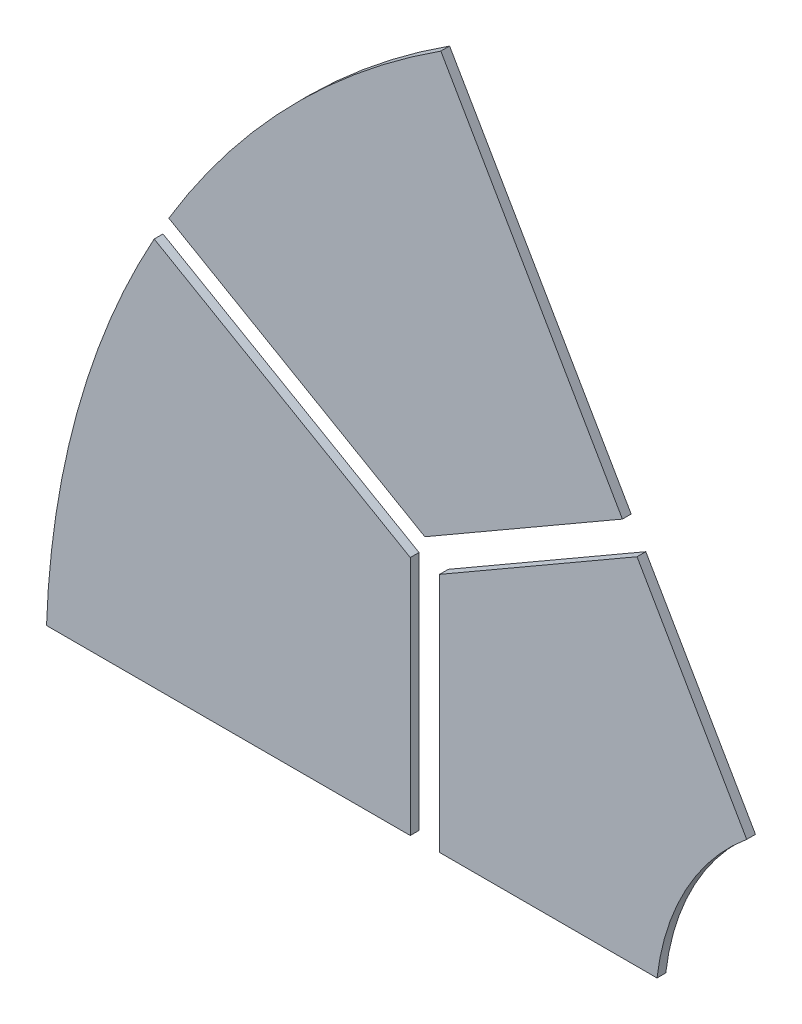
from build123d import *

# Parameters (mm, degrees)
BOSS_EXTRUDE1_DEPTH   = 6
BOSS_EXTRUDE1_2_DEPTH = 6
BOSS_EXTRUDE1_3_DEPTH = 6


with BuildPart() as part:
    # Sketch1 → Boss-Extrude1 (new body)
    with BuildSketch(Plane.XY):
        with BuildLine():
            ThreePointArc((-589.260689339, 20), (-568.194860877, 157.425411141), (-515.535131015, 286.097341284))
            Line((-515.535131015, 286.097341284), (-340.2, 184.867556195))
            Line((-340.2, 184.867556195), (-340.2, 20))
            Line((-340.2, 20), (-589.260689339, 20))
        make_face()
    extrude(amount=BOSS_EXTRUDE1_DEPTH)


with BuildPart() as body_2:
    # Sketch1 → Boss-Extrude1 2 (new body)
    with BuildSketch(Plane.XY):
        with BuildLine():
            ThreePointArc((-505.535131015, 303.41784936), (-423.458843967, 410.256952977), (-319.272010805, 495.674836073))
            Line((-319.272010805, 495.674836073), (-194.920508076, 280.291715349))
            Line((-194.920508076, 280.291715349), (-330.2, 202.18806427))
            Line((-330.2, 202.18806427), (-505.535131015, 303.41784936))
        make_face()
    extrude(amount=BOSS_EXTRUDE1_2_DEPTH)


with BuildPart() as body_3:
    # Sketch1 → Boss-Extrude1 3 (new body)
    with BuildSketch(Plane.XY):
        with BuildLine():
            ThreePointArc((-154.05140053, 77.394612181), (-165.156001883, 49.449520141), (-171.235977528, 20))
            Line((-171.235977528, 20), (-320.2, 20))
            Line((-320.2, 20), (-320.2, 173.320550811))
            Line((-320.2, 173.320550811), (-320.2, 184.867556195))
            Line((-320.2, 184.867556195), (-310.2, 190.641058886))
            Line((-310.2, 190.641058886), (-184.920508076, 262.971207273))
            Line((-184.920508076, 262.971207273), (-109.821022542, 132.895082707))
            ThreePointArc((-109.821022542, 132.895082707), (-128.363659898, 115.08488527), (-144.05140053, 94.715120257))
            ThreePointArc((-144.05140053, 94.715120257), (-149.302779612, 86.2), (-154.05140053, 77.394612181))
        make_face()
    extrude(amount=BOSS_EXTRUDE1_3_DEPTH)


solid = Compound([part.part, body_2.part, body_3.part])
